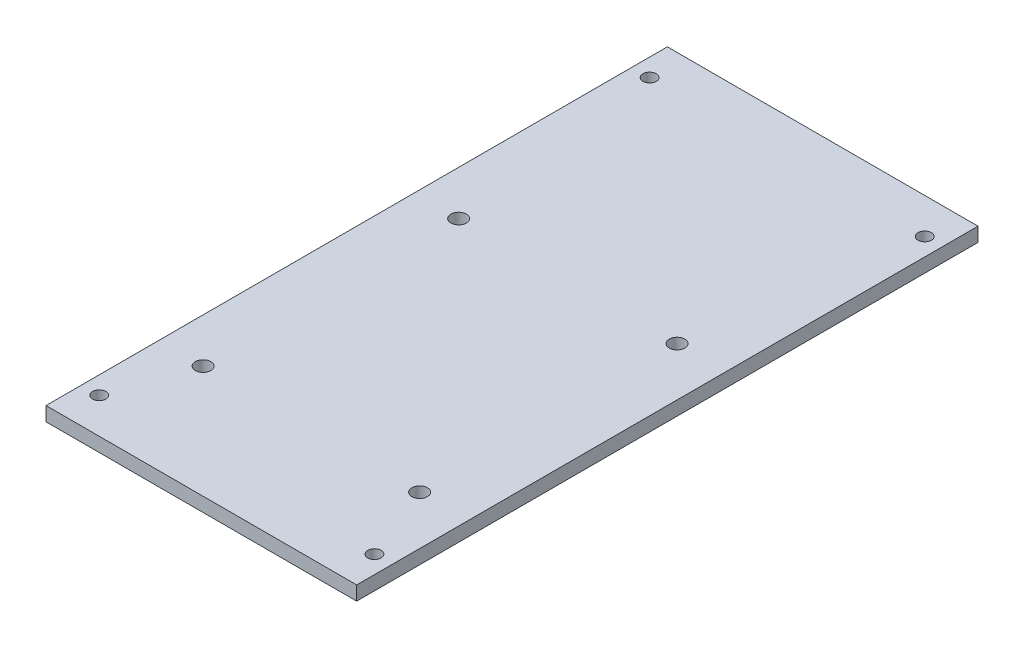
from build123d import *

# Parameters (mm, degrees)
SKETCH2_W           = 70
SKETCH2_H           = 140
SKETCH2_R           = 1.5
BOSS_EXTRUDE1_DEPTH = 3.175
SKETCH3_R           = 1.75
CUT_EXTRUDE1_DEPTH  = 79.326755486


with BuildPart() as part:
    # Sketch2 → Boss-Extrude1 (new body)
    with BuildSketch(Plane(origin=(0, 0, 0), x_dir=(1, 0, 0), z_dir=(0, 1, 0))):
        Rectangle(SKETCH2_W, SKETCH2_H)
        with Locations(Location((31, -62, 0), (0, 0, 270))):
            Circle(SKETCH2_R, mode=Mode.SUBTRACT)
        with Locations(Location((31, 62, 0), (0, 0, 90))):
            Circle(SKETCH2_R, mode=Mode.SUBTRACT)
        with Locations(Location((-31, 62, 0), (0, 0, 270))):
            Circle(SKETCH2_R, mode=Mode.SUBTRACT)
        with Locations(Location((-31, -62, 0), (0, 0, 90))):
            Circle(SKETCH2_R, mode=Mode.SUBTRACT)
    extrude(amount=BOSS_EXTRUDE1_DEPTH)

    # Sketch3 → Cut-Extrude1 (cut, through all)
    with BuildSketch(Plane(origin=(0, 3.175, 0), x_dir=(1, 0, 0), z_dir=(0, 1, 0))):
        with Locations(Location((-24.999549753, -44.6, 0), (0, 0, 270))):
            Circle(SKETCH3_R)
        with Locations(Location((24, -44.810057195, 0), (0, 0, 270))):
            Circle(SKETCH3_R)
        with Locations(Location((24, 13.189942805, 0), (0, 0, 90))):
            Circle(SKETCH3_R)
        with Locations(Location((-24.999549753, 12.97988561, 0), (0, 0, 90))):
            Circle(SKETCH3_R)
    extrude(amount=-CUT_EXTRUDE1_DEPTH, mode=Mode.SUBTRACT)


solid = part.part
